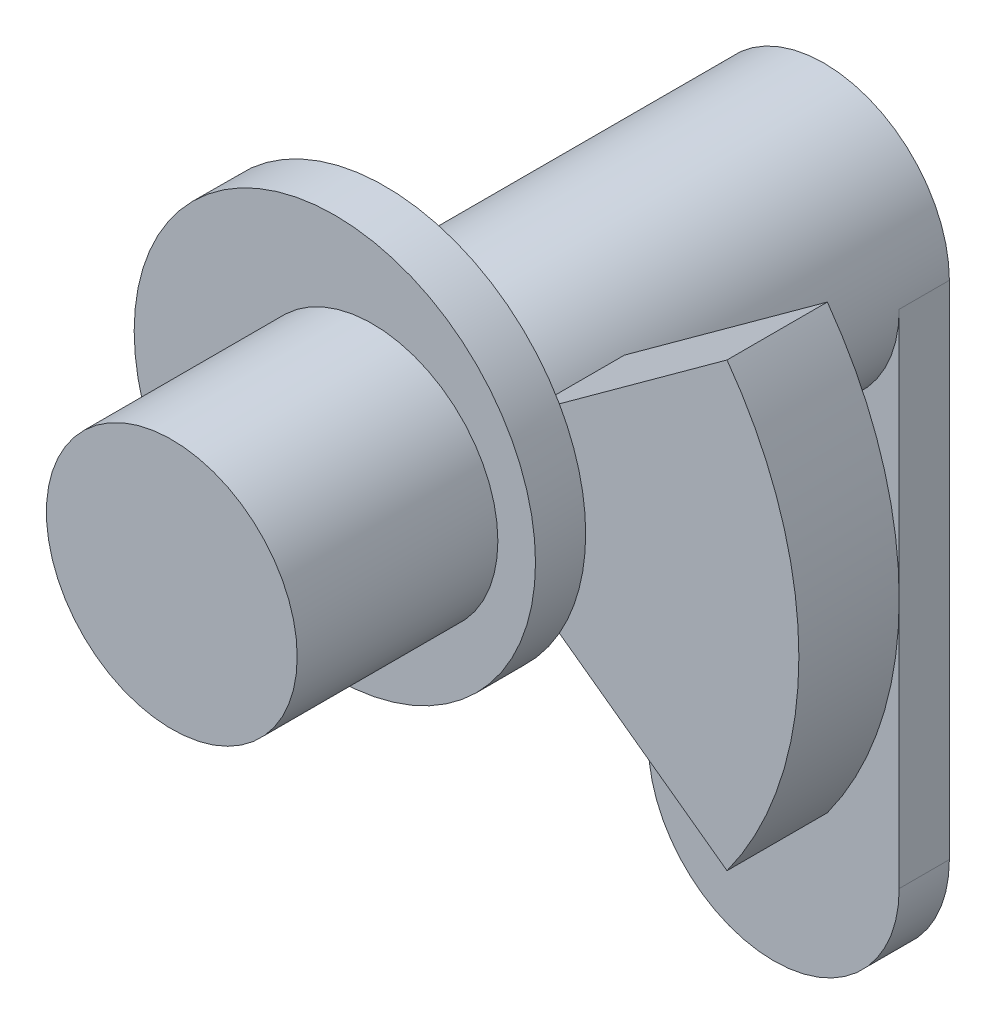
from build123d import *

# Parameters (mm, degrees)
SKETCH1_R           = 63.5
BOSS_EXTRUDE1_DEPTH = 330.2
BOSS_EXTRUDE2_DEPTH = 25.4
SKETCH3_R           = 101.6
BOSS_EXTRUDE3_DEPTH = 25.4
BOSS_EXTRUDE4_DEPTH = 50.8


with BuildPart() as part:
    # Sketch1 → Boss-Extrude1 (new body)
    with BuildSketch(Plane.XY):
        Circle(SKETCH1_R)
    extrude(amount=BOSS_EXTRUDE1_DEPTH)

    # Sketch2 → Boss-Extrude2 (add)
    with BuildSketch(Plane(origin=(0, 0, 0), x_dir=(-1, 0, 0), z_dir=(0, 0, -1))):
        with BuildLine():
            Line((63.5, 0), (63.5, -254))
            ThreePointArc((63.5, -254), (0, -317.5), (-63.5, -254))
            Line((-63.5, -254), (-63.5, 0))
            ThreePointArc((-63.5, 0), (0, 63.5), (63.5, 0))
        make_face()
    extrude(amount=-BOSS_EXTRUDE2_DEPTH)

    # Sketch3 → Boss-Extrude3 (add)
    with BuildSketch(Plane.XY.offset(228.6)):
        with Locations((-19.05, 0)):
            Circle(SKETCH3_R)
    extrude(amount=-BOSS_EXTRUDE3_DEPTH)

    # Sketch5 → Boss-Extrude4 (add)
    with BuildSketch(Plane.XY.offset(203.2)):
        with BuildLine():
            Line((0, 0), (154.117737428, 111.973090562))
            ThreePointArc((154.117737428, 111.973090562), (190.5, 0), (154.117737428, -111.973090562))
            Line((154.117737428, -111.973090562), (0, 0))
        make_face()
    extrude(amount=-BOSS_EXTRUDE4_DEPTH)


solid = part.part
